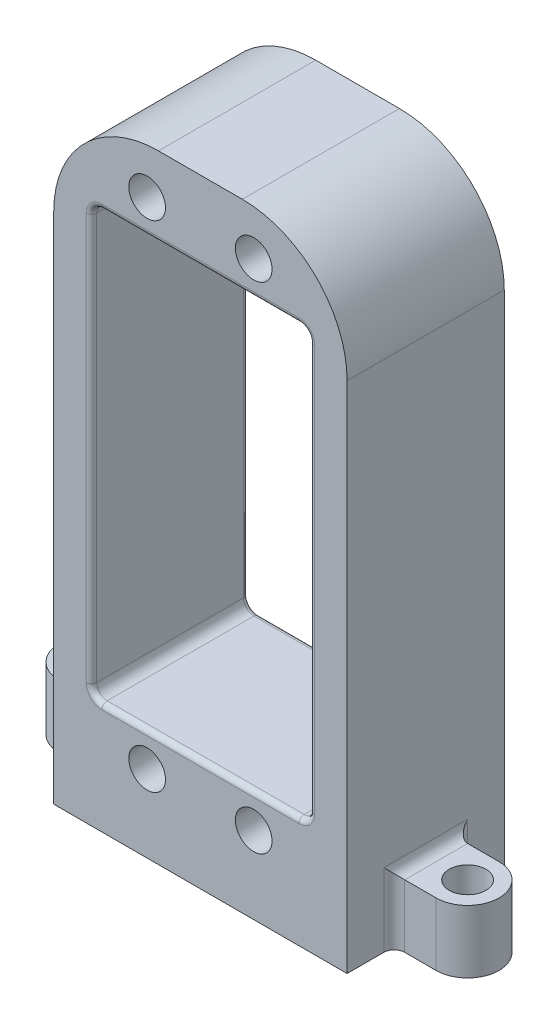
from build123d import *

# Parameters (mm, degrees)
SKETCH1_W           = 28
SKETCH1_H           = 56
SKETCH1_R           = 1.75
SKETCH1_W_2         = 20.8
SKETCH1_H_2         = 40.8
BOSS_EXTRUDE1_DEPTH = 15
FILLET1_R           = 10
FILLET2_R           = 1
FILLET3_R           = 0.5
SKETCH2_R           = 3
SKETCH2_R_2         = 1.75
BOSS_EXTRUDE2_DEPTH = 3
FILLET4_R           = 1
FILLET5_R           = 1
BOSS_EXTRUDE3_START = 3
SKETCH3_R           = 1.75
BOSS_EXTRUDE3_DEPTH = 3


with BuildPart() as part:
    # Sketch1 → Boss-Extrude1 (new body)
    with BuildSketch(Plane.XY):
        Rectangle(SKETCH1_W, SKETCH1_H)
        with Locations((-5.085, 23.63)):
            Circle(SKETCH1_R, mode=Mode.SUBTRACT)
        with Locations((5.085, 23.63)):
            Circle(SKETCH1_R, mode=Mode.SUBTRACT)
        with Locations((-5.085, -23.63)):
            Circle(SKETCH1_R, mode=Mode.SUBTRACT)
        with Locations((5.085, -23.63)):
            Circle(SKETCH1_R, mode=Mode.SUBTRACT)
        Rectangle(SKETCH1_W_2, SKETCH1_H_2, mode=Mode.SUBTRACT)
    extrude(amount=BOSS_EXTRUDE1_DEPTH)

    # Fillet1
    fillet1_edges = [part.edges().sort_by_distance(p)[0] for p in [
        (-14, 28, 7.5),
        (14, 28, 7.5),
    ]]
    fillet(fillet1_edges, radius=FILLET1_R)

    # Fillet2
    fillet2_edges = [part.edges().sort_by_distance(p)[0] for p in [
        (10.4, -20.4, 7.5),
        (10.4, 20.4, 7.5),
        (-10.4, 20.4, 7.5),
        (-10.4, -20.4, 7.5),
    ]]
    fillet(fillet2_edges, radius=FILLET2_R)

    # Fillet3
    fillet3_edges = [part.edges().sort_by_distance(p)[0] for p in [
        (0, -20.4, 0),
        (0, -20.4, 15),
        (10.4, 0, 0),
        (10.4, 0, 15),
        (-10.4, 0, 0),
        (-10.4, 0, 15),
        (0, 20.4, 0),
        (0, 20.4, 15),
        (10.107106781, -20.107106781, 0),
        (10.107106781, -20.107106781, 15),
        (-10.107106781, -20.107106781, 0),
        (-10.107106781, -20.107106781, 15),
        (-10.107106781, 20.107106781, 0),
        (-10.107106781, 20.107106781, 15),
        (10.107106781, 20.107106781, 0),
        (10.107106781, 20.107106781, 15),
    ]]
    fillet(fillet3_edges, radius=FILLET3_R)

    # Sketch2 → Boss-Extrude2 (add)
    # profile 1 of 4: a face of its own
    with BuildSketch(Plane.XZ.offset(28)):
        with Locations((-18, 7.5)):
            Circle(SKETCH2_R)
        with Locations(Location((-18, 7.5, 0), (0, 0, 270))):
            Circle(SKETCH2_R_2, mode=Mode.SUBTRACT)
    # profile 2 of 4: a face of its own
    with BuildSketch(Plane.XZ.offset(28)):
        with BuildLine():
            Line((-18, 4.5), (-14, 4.5))
            Line((-14, 4.5), (-14, 10.5))
            Line((-14, 10.5), (-18, 10.5))
            ThreePointArc((-18, 10.5), (-15.878679656, 9.621320344), (-15, 7.5))
            ThreePointArc((-15, 7.5), (-15.878679656, 5.378679656), (-18, 4.5))
        make_face()
    # profile 3 of 4: a face of its own
    with BuildSketch(Plane.XZ.offset(28)):
        with BuildLine():
            Line((14, 4.5), (18, 4.5))
            ThreePointArc((18, 4.5), (15, 7.5), (18, 10.5))
            Line((18, 10.5), (14, 10.5))
            Line((14, 10.5), (14, 4.5))
        make_face()
    # profile 4 of 4: a face of its own
    with BuildSketch(Plane.XZ.offset(28)):
        with Locations((18, 7.5)):
            Circle(SKETCH2_R)
        with Locations(Location((18, 7.5, 0), (0, 0, 270))):
            Circle(SKETCH2_R_2, mode=Mode.SUBTRACT)
    extrude(amount=-BOSS_EXTRUDE2_DEPTH)

    # Fillet4
    fillet4_edges = [part.edges().sort_by_distance(p)[0] for p in [
        (-14, -25, 7.5),
        (14, -25, 7.5),
    ]]
    fillet(fillet4_edges, radius=FILLET4_R)

    # Fillet5
    fillet5_edges = [part.edges().sort_by_distance(p)[0] for p in [
        (14, -26, 10.5),
        (14, -26, 4.5),
        (-14, -26, 4.5),
        (-14, -26, 10.5),
    ]]
    fillet(fillet5_edges, radius=FILLET5_R)

    # Sketch3 → Boss-Extrude3 (add)
    with BuildSketch(Plane.XZ.offset(28).offset(BOSS_EXTRUDE3_START)):
        with BuildLine():
            Line((-14, 0), (14, 0))
            Line((14, 0), (14, 3.5))
            ThreePointArc((14, 3.5), (14.292893219, 4.207106781), (15, 4.5))
            Line((15, 4.5), (18, 4.5))
            ThreePointArc((18, 4.5), (21, 7.5), (18, 10.5))
            Line((18, 10.5), (15, 10.5))
            ThreePointArc((15, 10.5), (14.292893219, 10.792893219), (14, 11.5))
            Line((14, 11.5), (14, 15))
            Line((14, 15), (-14, 15))
            Line((-14, 15), (-14, 11.5))
            ThreePointArc((-14, 11.5), (-14.292893219, 10.792893219), (-15, 10.5))
            Line((-15, 10.5), (-18, 10.5))
            ThreePointArc((-18, 10.5), (-21, 7.5), (-18, 4.5))
            Line((-18, 4.5), (-15, 4.5))
            ThreePointArc((-15, 4.5), (-14.292893219, 4.207106781), (-14, 3.5))
            Line((-14, 3.5), (-14, 0))
        make_face()
        with Locations(Location((18, 7.5, 0), (0, 0, 270))):
            Circle(SKETCH3_R, mode=Mode.SUBTRACT)
        with Locations(Location((-18, 7.5, 0), (0, 0, 270))):
            Circle(SKETCH3_R, mode=Mode.SUBTRACT)
    extrude(amount=-BOSS_EXTRUDE3_DEPTH)


solid = part.part
